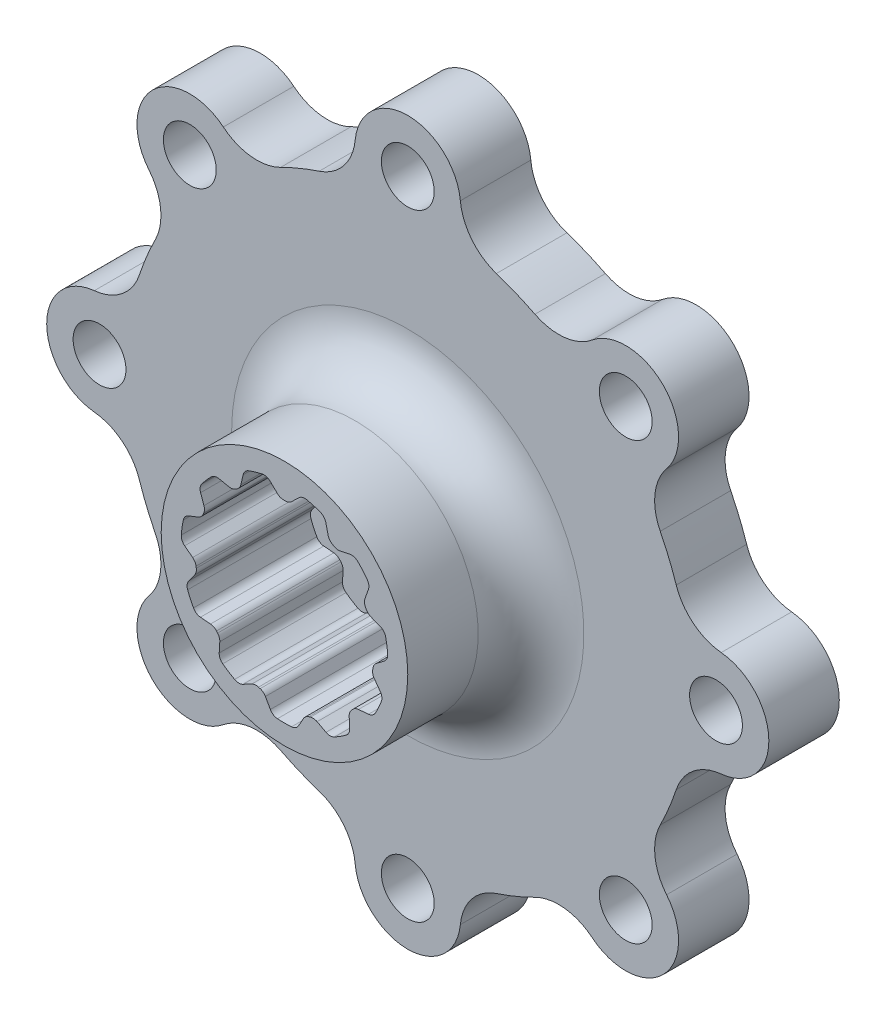
from build123d import *

# Parameters (mm, degrees)
SKETCH2_R                = 7
SKETCH2_R_2              = 5.875
BOSS_EXTRUDE1_DEPTH      = 7
SKETCH3_R                = 20.5
BOSS_EXTRUDE2_DEPTH      = 1
SKETCH4_R                = 20.5
SKETCH4_R_2              = 14.55
BOSS_EXTRUDE3_DEPTH      = 3
SKETCH5_R                = 1.5
CUT_EXTRUDE1_DEPTH       = 4
CIRPATTERN1_COUNT        = 8
SPLINE_START             = -7
SPLINE_TEETH_DEPTH       = 7
FILLET1_R                = 0.5
CIRPATTERN2_COUNT        = 11
FILLET1_OF_CIRPATTERN2_R = 0.5
SKETCH8_R                = 5.45
SKETCH8_R_2              = 4.45
BOSS_EXTRUDE4_DEPTH      = 3
SKETCH9_R                = 21.5
CUT_EXTRUDE3_DEPTH       = 4
FILLET2_R                = 3
FILLET3_R                = 3


with BuildPart() as part:
    # Sketch2 → Boss-Extrude1 (new body)
    with BuildSketch(Plane.XY):
        Circle(SKETCH2_R)
        Circle(SKETCH2_R_2, mode=Mode.SUBTRACT)
    extrude(amount=BOSS_EXTRUDE1_DEPTH)

    # Sketch3 → Boss-Extrude2 (add)
    with BuildSketch(Plane(origin=(0, 0, 0), x_dir=(-1, 0, 0), z_dir=(0, 0, -1))):
        Circle(SKETCH3_R)
    extrude(amount=BOSS_EXTRUDE2_DEPTH)

    # Sketch4 → Boss-Extrude3 (add)
    with BuildSketch(Plane(origin=(0, 0, -1), x_dir=(-1, 0, 0), z_dir=(0, 0, -1))):
        Circle(SKETCH4_R)
        Circle(SKETCH4_R_2, mode=Mode.SUBTRACT)
    extrude(amount=BOSS_EXTRUDE3_DEPTH)

    # Sketch5 → Cut-Extrude1 (cut)
    with BuildSketch(Plane(origin=(0, 0, -4), x_dir=(-1, 0, 0), z_dir=(0, 0, -1))):
        with Locations((0, 17.5)):
            Circle(SKETCH5_R)
    cut_extrude1 = extrude(amount=-CUT_EXTRUDE1_DEPTH, mode=Mode.SUBTRACT)

    # CirPattern1: Cut-Extrude1 ×8 about axis
    cirpattern1_axis = Axis((0, 0, 0), (0, 0, 1))
    for i in range(1, CIRPATTERN1_COUNT):
        add(cut_extrude1.rotate(cirpattern1_axis, i * 360 / CIRPATTERN1_COUNT), mode=Mode.SUBTRACT)

    # Sketch7 → spline teeth (add)
    with BuildSketch(Plane.XY.offset(7).offset(SPLINE_START)):
        with BuildLine():
            Line((-0.25, 5.060775448), (-1, 5.789268088))
            ThreePointArc((-1, 5.789268088), (0, 5.875), (1, 5.789268088))
            Line((1, 5.789268088), (0.25, 5.060775448))
            ThreePointArc((0.25, 5.060775448), (0, 5.066946629), (-0.25, 5.060775448))
        make_face()
    spline_teeth = extrude(amount=SPLINE_TEETH_DEPTH)

    # Fillet1
    fillet1_edges = [part.edges().sort_by_distance(p)[0] for p in [
        (-0.25, 5.060775448, 3.5),
        (0.25, 5.060775448, 3.5),
        (1, 5.789268088, 3.5),
        (-1, 5.789268088, 3.5),
    ]]
    fillet(fillet1_edges, radius=FILLET1_R)

    # CirPattern2: spline teeth ×11 about axis
    cirpattern2_axis = Axis((0, 0, 0), (0, 0, 1))
    for i in range(1, CIRPATTERN2_COUNT):
        add(spline_teeth.rotate(cirpattern2_axis, i * 360 / CIRPATTERN2_COUNT))

    # Fillet1 of CirPattern2
    fillet1_of_cirpattern2_edges = [part.edges().sort_by_distance(p)[0] for p in [
        (-2.946375158, 4.12223502, 3.5),
        (-2.525748392, 4.392555429, 3.5),
        (-2.288661099, 5.410883049, 3.5),
        (-3.971168165, 4.329601414, 3.5),
        (-4.707297022, 1.8749141, 3.5),
        (-4.499589516, 2.329730097, 3.5),
        (-4.85068847, 3.314580874, 3.5),
        (-5.681518496, 1.495316883, 3.5),
        (-4.973685342, -0.9676788, 3.5),
        (-5.044842761, -0.472768079, 3.5),
        (-5.872656525, 0.16592269, 3.5),
        (-5.588026848, -1.813720194, 3.5),
        (-3.660963707, -3.503040518, 3.5),
        (-3.988394074, -3.125165731, 3.5),
        (-5.030097628, -3.035414775, 3.5),
        (-3.72037616, -4.546913924, 3.5),
        (-1.185911963, -4.926211623, 3.5),
        (-1.66565845, -4.785345344, 3.5),
        (-2.590518274, -5.273029496, 3.5),
        (-0.671532327, -5.83649461, 3.5),
        (1.66565845, -4.785345344, 3.5),
        (1.185911963, -4.926211623, 3.5),
        (0.671532327, -5.83649461, 3.5),
        (2.590518274, -5.273029496, 3.5),
        (3.988394074, -3.125165731, 3.5),
        (3.660963707, -3.503040518, 3.5),
        (3.72037616, -4.546913924, 3.5),
        (5.030097628, -3.035414775, 3.5),
        (5.044842761, -0.472768079, 3.5),
        (4.973685342, -0.9676788, 3.5),
        (5.588026848, -1.813720194, 3.5),
        (5.872656525, 0.16592269, 3.5),
        (4.499589516, 2.329730097, 3.5),
        (4.707297022, 1.8749141, 3.5),
        (5.681518496, 1.495316883, 3.5),
        (4.85068847, 3.314580874, 3.5),
        (2.525748392, 4.392555429, 3.5),
        (2.946375158, 4.12223502, 3.5),
        (3.971168165, 4.329601414, 3.5),
        (2.288661099, 5.410883049, 3.5),
    ]]
    fillet(fillet1_of_cirpattern2_edges, radius=FILLET1_OF_CIRPATTERN2_R)

    # Sketch8 → Boss-Extrude4 (add)
    with BuildSketch(Plane(origin=(0, 0, -1), x_dir=(-1, 0, 0), z_dir=(0, 0, -1))):
        Circle(SKETCH8_R)
        Circle(SKETCH8_R_2, mode=Mode.SUBTRACT)
    extrude(amount=BOSS_EXTRUDE4_DEPTH)

    # Sketch9 → Cut-Extrude3 (cut)
    with BuildSketch(Plane(origin=(0, 0, -4), x_dir=(-1, 0, 0), z_dir=(0, 0, -1))):
        Circle(SKETCH9_R)
        with BuildLine():
            Line((-14.495689014, 10.253048327), (-13.270367388, 9.027726701))
            ThreePointArc((-13.270367388, 9.027726701), (-14.828266497, 6.142069089), (-15.767133538, 3))
            Line((-15.767133538, 3), (-17.5, 3))
            ThreePointArc((-17.5, 3), (-20.5, 0), (-17.5, -3))
            Line((-17.5, -3), (-15.767133538, -3))
            ThreePointArc((-15.767133538, -3), (-14.828266497, -6.142069089), (-13.270367388, -9.027726701))
            Line((-13.270367388, -9.027726701), (-14.495689014, -10.253048327))
            ThreePointArc((-14.495689014, -10.253048327), (-14.495689014, -14.495689014), (-10.253048327, -14.495689014))
            Line((-10.253048327, -14.495689014), (-9.027726701, -13.270367388))
            ThreePointArc((-9.027726701, -13.270367388), (-6.142069089, -14.828266497), (-3, -15.767133538))
            Line((-3, -15.767133538), (-3, -17.5))
            ThreePointArc((-3, -17.5), (0, -20.5), (3, -17.5))
            Line((3, -17.5), (3, -15.767133538))
            ThreePointArc((3, -15.767133538), (6.142069089, -14.828266497), (9.027726701, -13.270367388))
            Line((9.027726701, -13.270367388), (10.253048327, -14.495689014))
            ThreePointArc((10.253048327, -14.495689014), (14.495689014, -14.495689014), (14.495689014, -10.253048327))
            Line((14.495689014, -10.253048327), (13.270367388, -9.027726701))
            ThreePointArc((13.270367388, -9.027726701), (14.828266497, -6.142069089), (15.767133538, -3))
            Line((15.767133538, -3), (17.5, -3))
            ThreePointArc((17.5, -3), (20.5, 0), (17.5, 3))
            Line((17.5, 3), (15.767133538, 3))
            ThreePointArc((15.767133538, 3), (14.828266497, 6.142069089), (13.270367388, 9.027726701))
            Line((13.270367388, 9.027726701), (14.495689014, 10.253048327))
            ThreePointArc((14.495689014, 10.253048327), (14.495689014, 14.495689014), (10.253048327, 14.495689014))
            Line((10.253048327, 14.495689014), (9.027726701, 13.270367388))
            ThreePointArc((9.027726701, 13.270367388), (6.142069089, 14.828266497), (3, 15.767133538))
            Line((3, 15.767133538), (3, 17.5))
            ThreePointArc((3, 17.5), (0, 20.5), (-3, 17.5))
            Line((-3, 17.5), (-3, 15.767133538))
            ThreePointArc((-3, 15.767133538), (-6.142069089, 14.828266497), (-9.027726701, 13.270367388))
            Line((-9.027726701, 13.270367388), (-10.253048327, 14.495689014))
            ThreePointArc((-10.253048327, 14.495689014), (-14.495689014, 14.495689014), (-14.495689014, 10.253048327))
        make_face(mode=Mode.SUBTRACT)
    extrude(amount=-CUT_EXTRUDE3_DEPTH, mode=Mode.SUBTRACT)

    # Fillet2
    fillet2_edges = [part.edges().sort_by_distance(p)[0] for p in [
        (-15.767133538, -3, -2),
        (-15.767133538, 3, -2),
        (-13.270367388, 9.027726701, -2),
        (-9.027726701, 13.270367388, -2),
        (-3, 15.767133538, -2),
        (3, 15.767133538, -2),
        (9.027726701, 13.270367388, -2),
        (15.767133538, 3, -2),
        (3, -15.767133538, -2),
        (13.270367388, -9.027726701, -2),
        (13.270367388, 9.027726701, -2),
        (15.767133538, -3, -2),
        (9.027726701, -13.270367388, -2),
        (-3, -15.767133538, -2),
        (-9.027726701, -13.270367388, -2),
        (-13.270367388, -9.027726701, -2),
    ]]
    fillet(fillet2_edges, radius=FILLET2_R)

    # Fillet3
    fillet3_edges = [part.edges().sort_by_distance(p)[0] for p in [
        (-7, 0, 0),
    ]]
    fillet(fillet3_edges, radius=FILLET3_R)


solid = part.part
